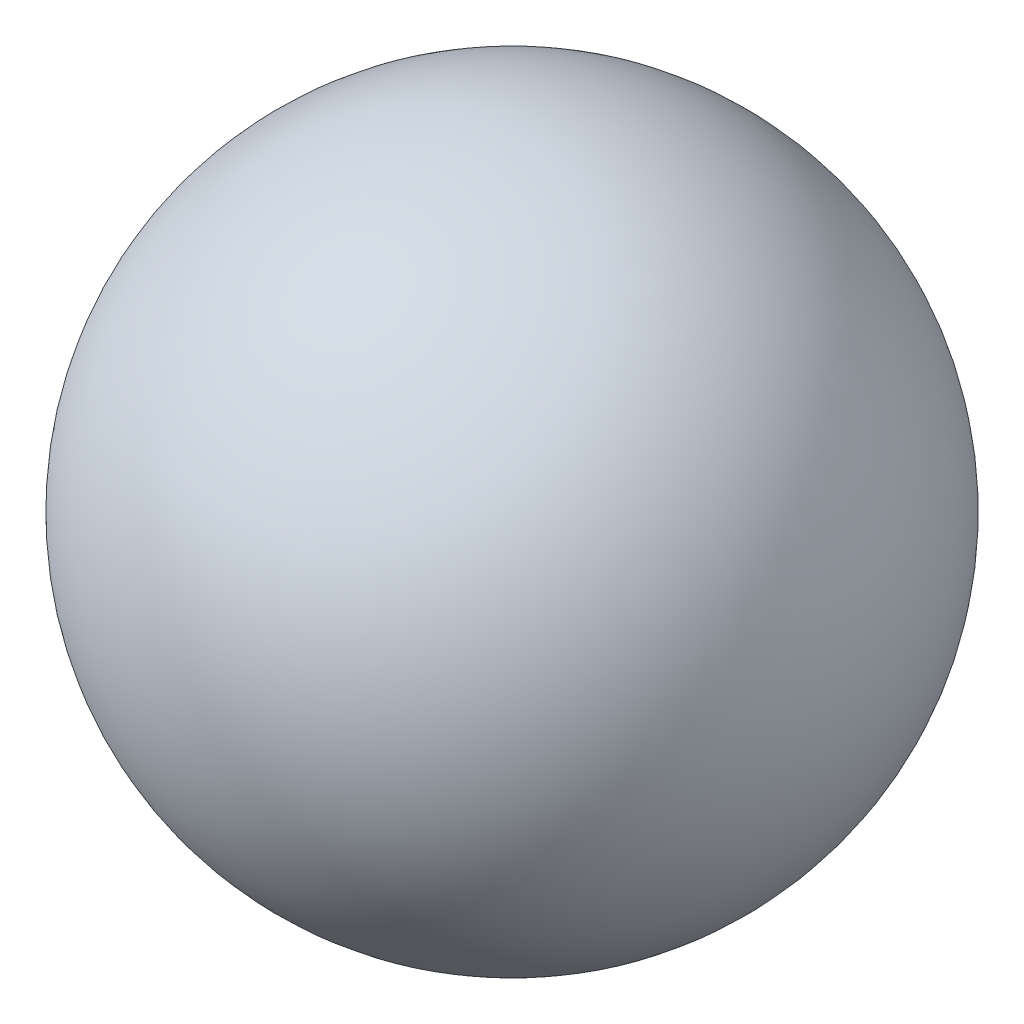
from build123d import *


with BuildPart() as part:
    # Sketch1 → Revolve4 (revolve)
    with BuildSketch(Plane.XY):
        with BuildLine():
            Line((0, 2.25), (0, -2.25))
            ThreePointArc((0, -2.25), (2.25, 0), (0, 2.25))
        make_face()
    revolve(axis=Axis((0, 3.452032366, 0), (0, -1, 0)))


solid = part.part
